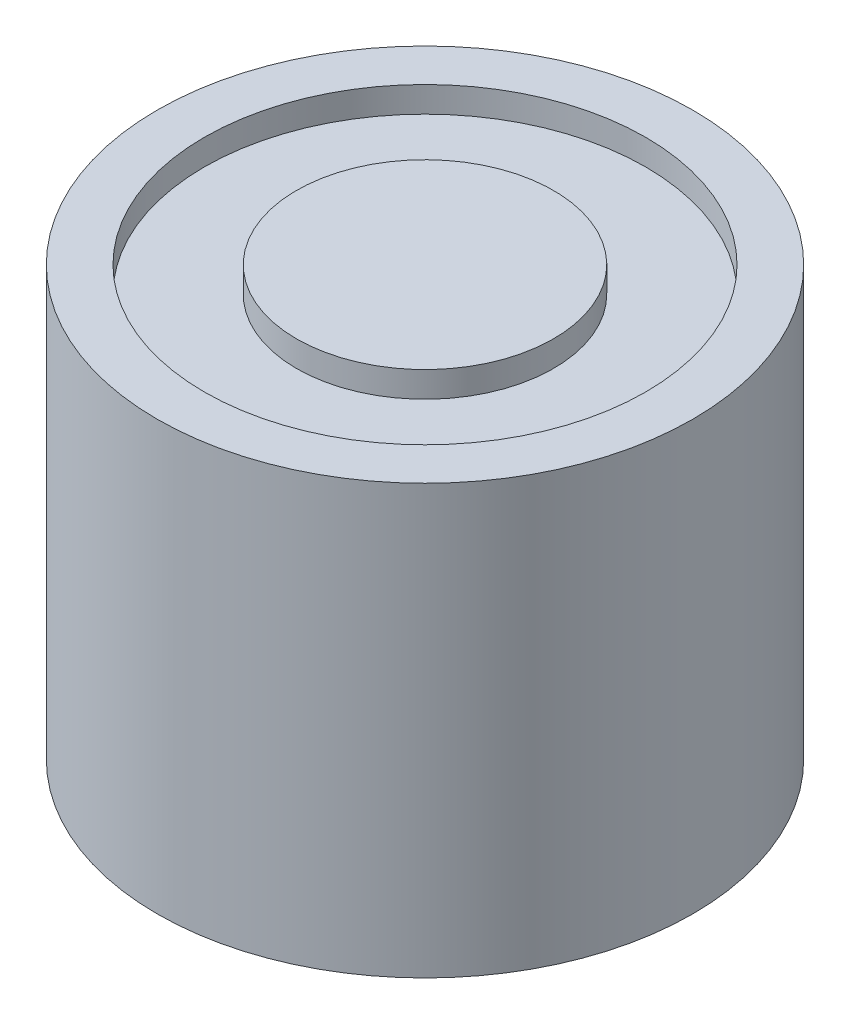
from build123d import *

# Parameters (mm, degrees)
SKETCH2_R           = 12.5
BOSS_EXTRUDE1_DEPTH = 20
SKETCH3_R           = 10.3
SKETCH3_R_2         = 6
CUT_EXTRUDE1_DEPTH  = 1.2
SKETCH4_R           = 2
CUT_EXTRUDE2_DEPTH  = 12


with BuildPart() as part:
    # Sketch2 → Boss-Extrude1 (new body)
    with BuildSketch(Plane(origin=(0, 0, 0), x_dir=(1, 0, 0), z_dir=(0, 1, 0))):
        with Locations(Location((0, 0, 0), (0, 0, 270))):
            Circle(SKETCH2_R)
    extrude(amount=BOSS_EXTRUDE1_DEPTH)

    # Sketch3 → Cut-Extrude1 (cut)
    with BuildSketch(Plane(origin=(0, 20, 0), x_dir=(1, 0, 0), z_dir=(0, 1, 0))):
        with Locations(Location((0, 0, 0), (0, 0, 270))):
            Circle(SKETCH3_R)
        with Locations(Location((0, 0, 0), (0, 0, 270))):
            Circle(SKETCH3_R_2, mode=Mode.SUBTRACT)
    extrude(amount=-CUT_EXTRUDE1_DEPTH, mode=Mode.SUBTRACT)

    # Sketch4 → Cut-Extrude2 (cut)
    with BuildSketch(Plane.XZ):
        with Locations(Location((0, 0, 0), (0, 0, 270))):
            Circle(SKETCH4_R)
    extrude(amount=-CUT_EXTRUDE2_DEPTH, mode=Mode.SUBTRACT)


solid = part.part
